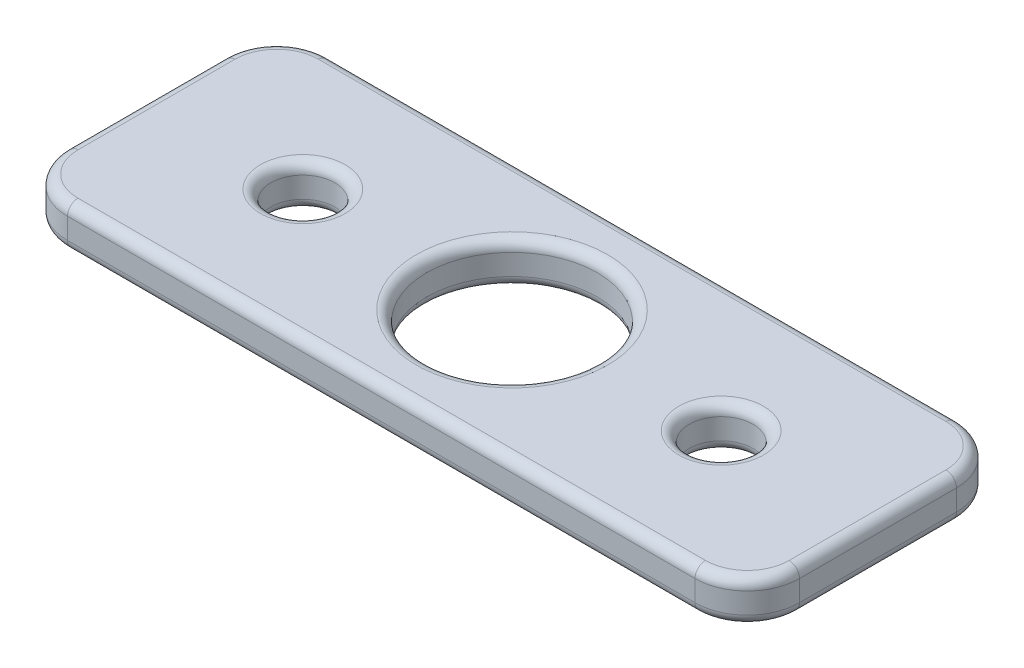
from build123d import *

# Parameters (mm, degrees)
SKETCH1_W           = 70
SKETCH1_H           = 25
SKETCH1_R           = 3.05
SKETCH1_R_2         = 8.15
BOSS_EXTRUDE1_DEPTH = 4
FILLET1_R           = 5
FILLET2_R           = 1


with BuildPart() as part:
    # Sketch1 → Boss-Extrude1 (new body)
    with BuildSketch(Plane(origin=(0, 0, 0), x_dir=(1, 0, 0), z_dir=(0, 1, 0))):
        with Locations((35, 12.5)):
            Rectangle(SKETCH1_W, SKETCH1_H)
        with Locations(Location((15, 12.5, 0), (0, 0, 270))):
            Circle(SKETCH1_R, mode=Mode.SUBTRACT)
        with Locations(Location((35, 12.5, 0), (0, 0, 270))):
            Circle(SKETCH1_R_2, mode=Mode.SUBTRACT)
        with Locations(Location((55, 12.5, 0), (0, 0, 90))):
            Circle(SKETCH1_R, mode=Mode.SUBTRACT)
    extrude(amount=BOSS_EXTRUDE1_DEPTH)

    # Fillet1
    fillet1_edges = [part.edges().sort_by_distance(p)[0] for p in [
        (0, 2, -25),
        (70, 2, -25),
        (70, 2, 0),
        (0, 2, 0),
    ]]
    fillet(fillet1_edges, radius=FILLET1_R)

    # Fillet2
    fillet2_edges = [part.edges().sort_by_distance(p)[0] for p in [
        (15, 0, -15.55),
        (15, 4, -15.55),
        (35, 0, -20.65),
        (35, 4, -20.65),
        (55, 0, -9.45),
        (55, 4, -9.45),
        (35, 0, -25),
        (35, 4, -25),
        (0, 0, -12.5),
        (70, 0, -12.5),
        (35, 0, 0),
        (68.535533906, 0, -1.464466094),
        (1.464466094, 0, -1.464466094),
        (1.464466094, 0, -23.535533906),
        (68.535533906, 0, -23.535533906),
        (70, 4, -12.5),
        (0, 4, -12.5),
        (35, 4, 0),
        (68.535533906, 4, -1.464466094),
        (1.464466094, 4, -1.464466094),
        (1.464466094, 4, -23.535533906),
        (68.535533906, 4, -23.535533906),
    ]]
    fillet(fillet2_edges, radius=FILLET2_R)


solid = part.part
